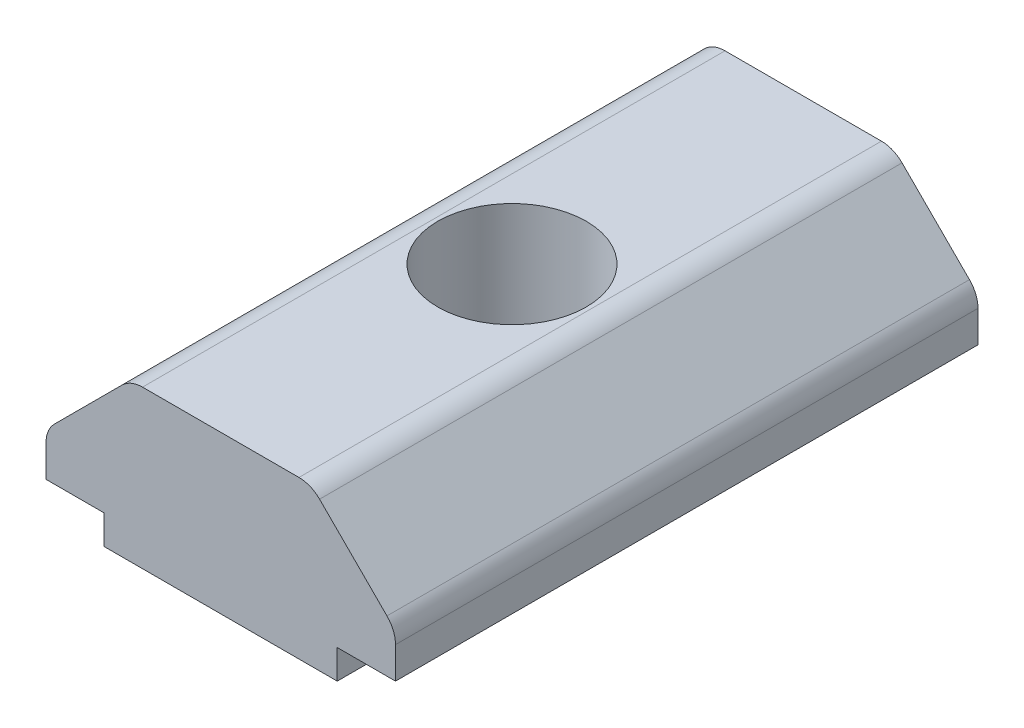
from build123d import *

# Parameters (mm, degrees)
EXTRUDE1_DEPTH = 20
FILLET1_R      = 1
SKETCH2_R      = 2.55
EXTRUDE2_DEPTH = 24.003477998


with BuildPart() as part:
    # Sketch1 → Extrude1 (new body)
    with BuildSketch(Plane.XY):
        Polygon((0, 0), (8, 0), (8, 1), (10, 1), (10, 2.5), (7.1, 5.4), (0.9, 5.4), (-2, 2.5), (-2, 1), (0, 1), align=None)
    extrude(amount=EXTRUDE1_DEPTH)

    # Fillet1
    fillet1_edges = [part.edges().sort_by_distance(p)[0] for p in [
        (-2, 2.5, 10),
        (0.9, 5.4, 10),
        (7.1, 5.4, 10),
        (10, 2.5, 10),
    ]]
    fillet(fillet1_edges, radius=FILLET1_R)

    # Sketch2 → Extrude2 (cut, through all)
    with BuildSketch(Plane(origin=(0, 5.4, 0), x_dir=(1, 0, 0), z_dir=(0, 1, 0))):
        with Locations(Location((4, -10, 0), (0, 0, 270))):
            Circle(SKETCH2_R)
    extrude(amount=-EXTRUDE2_DEPTH, mode=Mode.SUBTRACT)


solid = part.part
